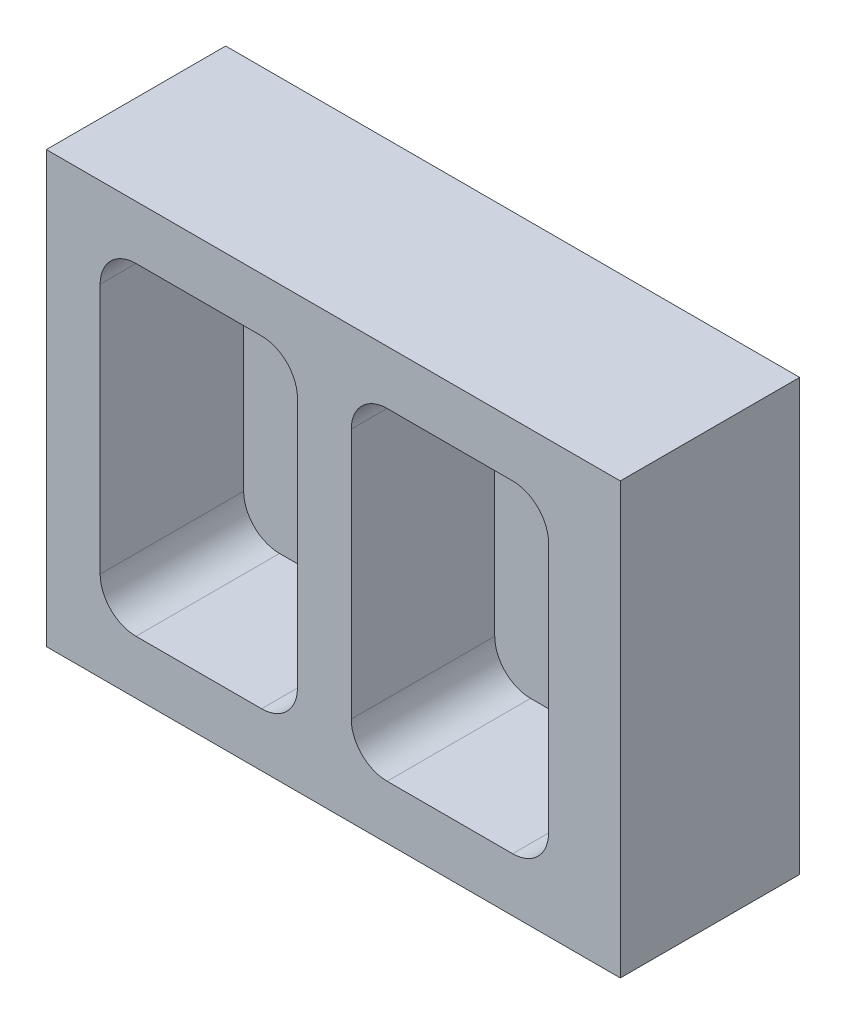
from build123d import *

# Parameters (mm, degrees)
SKETCH1_W          = 203.2
SKETCH1_H          = 152.4
BASE_EXTRUDE_DEPTH = 63.5
CUT_EXTRUDE1_DEPTH = 50.8


with BuildPart() as part:
    # Sketch1 → Base-Extrude (new body)
    with BuildSketch(Plane.XY):
        Rectangle(SKETCH1_W, SKETCH1_H)
    extrude(amount=-BASE_EXTRUDE_DEPTH)

    # Sketch2 → Cut-Extrude1 (cut)
    with BuildSketch(Plane.XY):
        with BuildLine():
            Line((-69.85, 57.15), (-25.4, 57.15))
            ThreePointArc((-25.4, 57.15), (-16.419743879, 53.430256121), (-12.7, 44.45))
            Line((-12.7, 44.45), (-12.7, -44.45))
            ThreePointArc((-12.7, -44.45), (-16.419743879, -53.430256121), (-25.4, -57.15))
            Line((-25.4, -57.15), (-69.85, -57.15))
            ThreePointArc((-69.85, -57.15), (-78.830256121, -53.430256121), (-82.55, -44.45))
            Line((-82.55, -44.45), (-82.55, 44.45))
            ThreePointArc((-82.55, 44.45), (-78.830256121, 53.430256121), (-69.85, 57.15))
        make_face()
        with BuildLine():
            Line((19.05, 57.15), (63.5, 57.15))
            ThreePointArc((63.5, 57.15), (72.480256121, 53.430256121), (76.2, 44.45))
            Line((76.2, 44.45), (76.2, -44.45))
            ThreePointArc((76.2, -44.45), (72.480256121, -53.430256121), (63.5, -57.15))
            Line((63.5, -57.15), (19.05, -57.15))
            ThreePointArc((19.05, -57.15), (10.069743879, -53.430256121), (6.35, -44.45))
            Line((6.35, -44.45), (6.35, 44.45))
            ThreePointArc((6.35, 44.45), (10.069743879, 53.430256121), (19.05, 57.15))
        make_face()
    extrude(amount=-CUT_EXTRUDE1_DEPTH, mode=Mode.SUBTRACT)


solid = part.part
